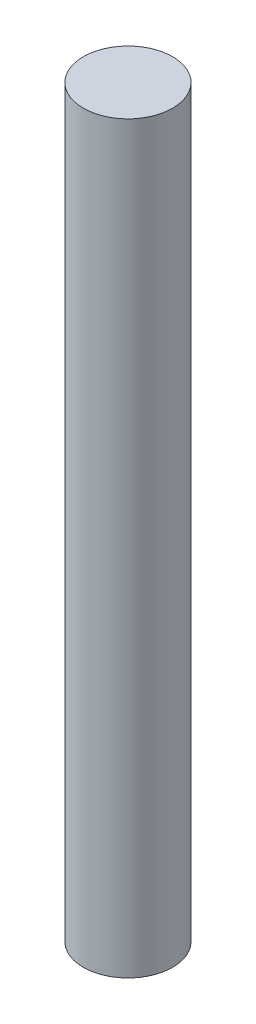
from build123d import *

# Parameters (mm, degrees)
SKETCH1_R           = 3
BOSS_EXTRUDE1_DEPTH = 50


with BuildPart() as part:
    # Sketch1 → Boss-Extrude1 (new body)
    with BuildSketch(Plane(origin=(0, 0, 0), x_dir=(1, 0, 0), z_dir=(0, 1, 0))):
        with Locations(Location((0, 0, 0), (0, 0, 270))):
            Circle(SKETCH1_R)
    extrude(amount=BOSS_EXTRUDE1_DEPTH)


solid = part.part
